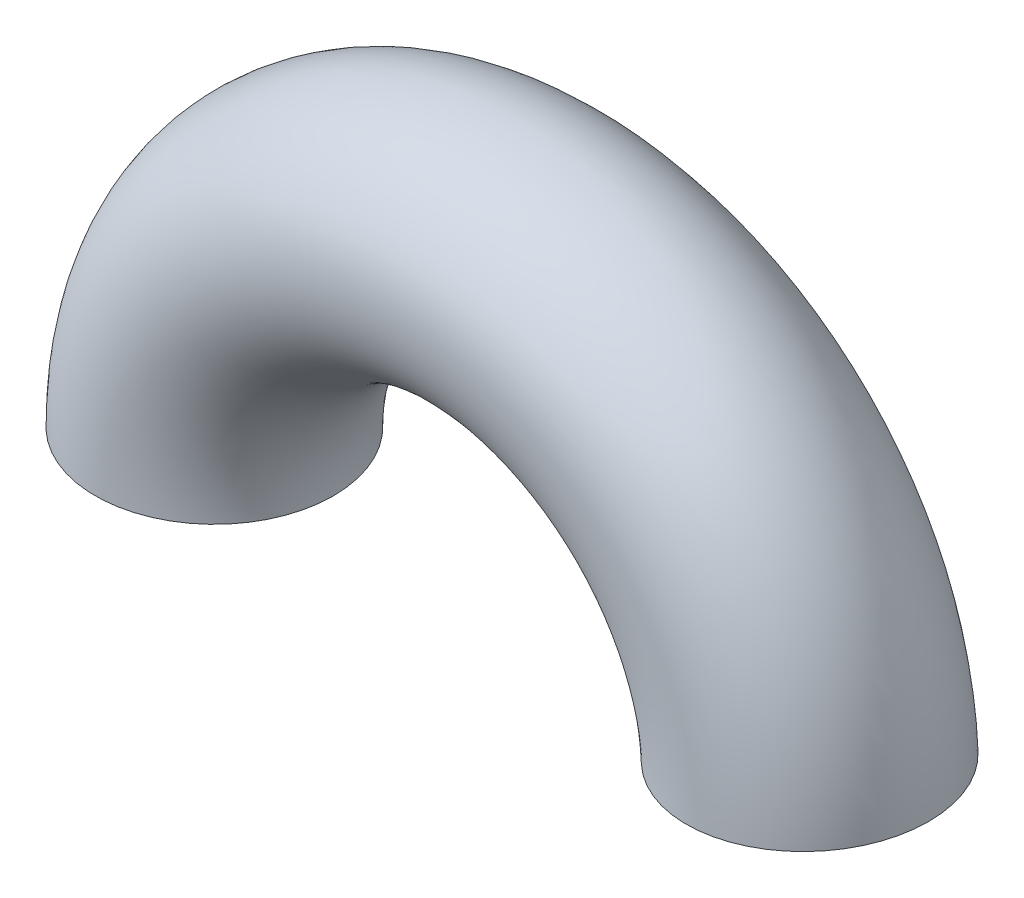
from build123d import *

# Parameters (mm, degrees)
SKETCH2_R = 5
SHELL1_T  = -0.5


with BuildPart() as part:
    # Sweep1: sweep along a path in Sketch3
    with BuildLine(Plane.XY) as sweep1_path:
        ThreePointArc((0, 0), (12.266474782, 12.497818449), (24.991274556, 0.466968925))
    # Sketch2 → Sweep1 (sweep)
    with BuildSketch(Plane(origin=(0, 0, 0), x_dir=(1, 0, 0), z_dir=(0, 1, 0))):
        Circle(SKETCH2_R)
    sweep(path=sweep1_path.line)

    # Shell1
    shell1_openings = [part.faces().sort_by_distance(p)[0] for p in [
        (24.991274556, 0.466968925, 0),
        (0, 0, 0),
    ]]
    offset(amount=SHELL1_T, openings=shell1_openings, kind=Kind.INTERSECTION)


solid = part.part
